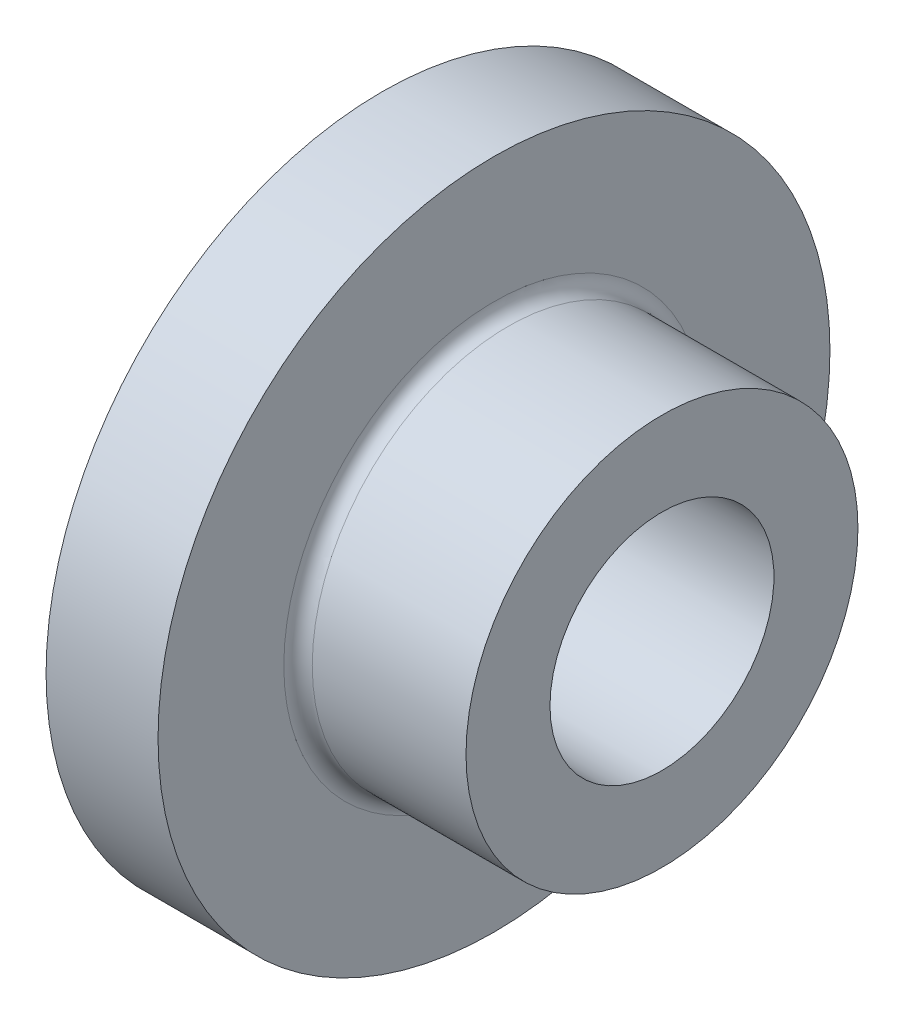
from build123d import *

# Parameters (mm, degrees)
FILLET1_R = 0.254


with BuildPart() as part:
    # Sketch1 → Revolve1 (revolve)
    with BuildSketch(Plane.XY, mode=Mode.PRIVATE) as revolve1_sk:
        Polygon((0, 2), (0, 6), (2, 6), (2, 3.5), (5, 3.5), (5, 2), align=None)
    revolve(revolve1_sk.sketch.rotate(Axis((0, 0, 0), (1, 0, 0)), 90), axis=Axis((0, 0, 0), (1, 0, 0)))

    # Fillet1
    fillet1_edges = [part.edges().sort_by_distance(p)[0] for p in [
        (2, 0, -3.5),
    ]]
    fillet(fillet1_edges, radius=FILLET1_R)


solid = part.part
